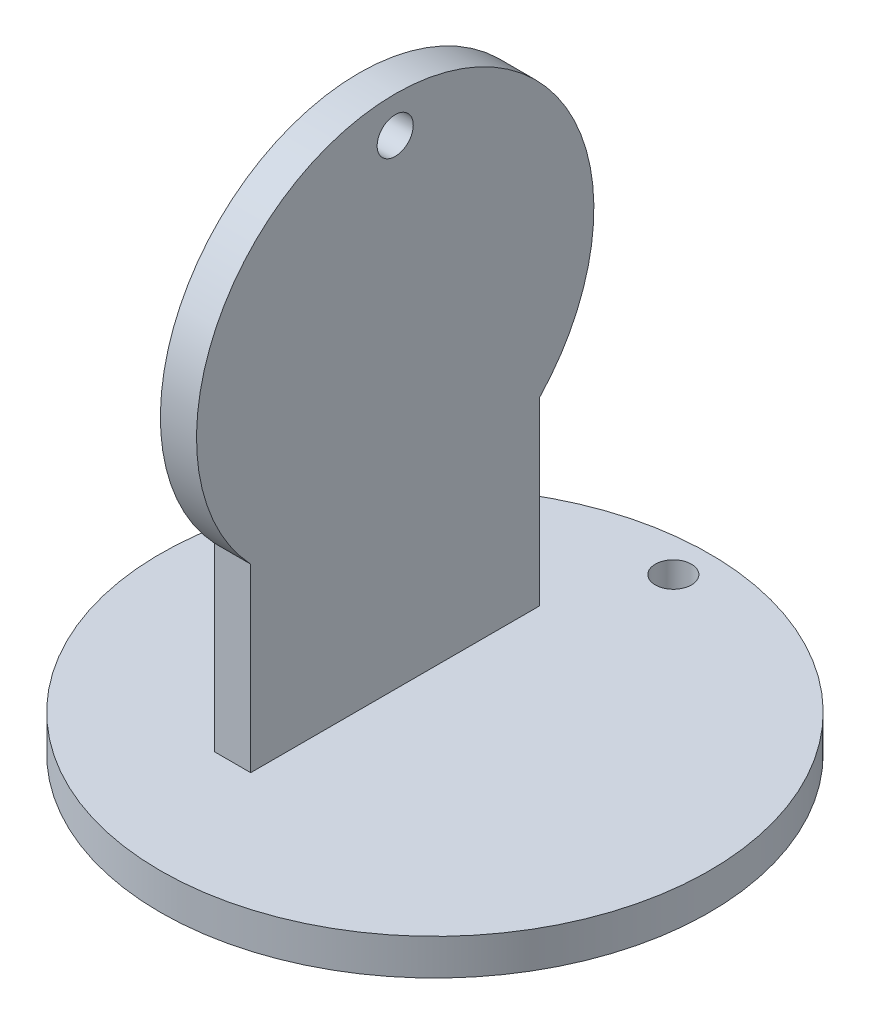
from build123d import *

# Parameters (mm, degrees)
SKETCH_1_R      = 38
SKETCH_1_R_2    = 2.5
EXTRUDE_1_DEPTH = 5
SKETCH_5_R      = 2.5
EXTRUDE_3_DEPTH = 5


with BuildPart() as part:
    # 草图1 → 凸台-拉伸1 (new body)
    with BuildSketch(Plane(origin=(0, 0, 0), x_dir=(1, 0, 0), z_dir=(0, 1, 0))):
        with Locations(Location((0, 0, 0), (0, 0, 270))):
            Circle(SKETCH_1_R)
        with Locations(Location((0, 33, 0), (0, 0, 270))):
            Circle(SKETCH_1_R_2, mode=Mode.SUBTRACT)
    extrude(amount=EXTRUDE_1_DEPTH)

    # 草图5 → 凸台-拉伸3 (add)
    with BuildSketch(Plane(origin=(-10.5, 0, 0), x_dir=(0, 0, -1), z_dir=(1, 0, 0))):
        with BuildLine():
            Line((-20, 30), (-20, 5))
            Line((-20, 5), (20, 5))
            Line((20, 5), (20, 30))
            ThreePointArc((20, 30), (0, 76.374586088), (-20, 30))
        make_face()
        with Locations((0, 71.374586088)):
            Circle(SKETCH_5_R, mode=Mode.SUBTRACT)
    extrude(amount=EXTRUDE_3_DEPTH)


solid = part.part
